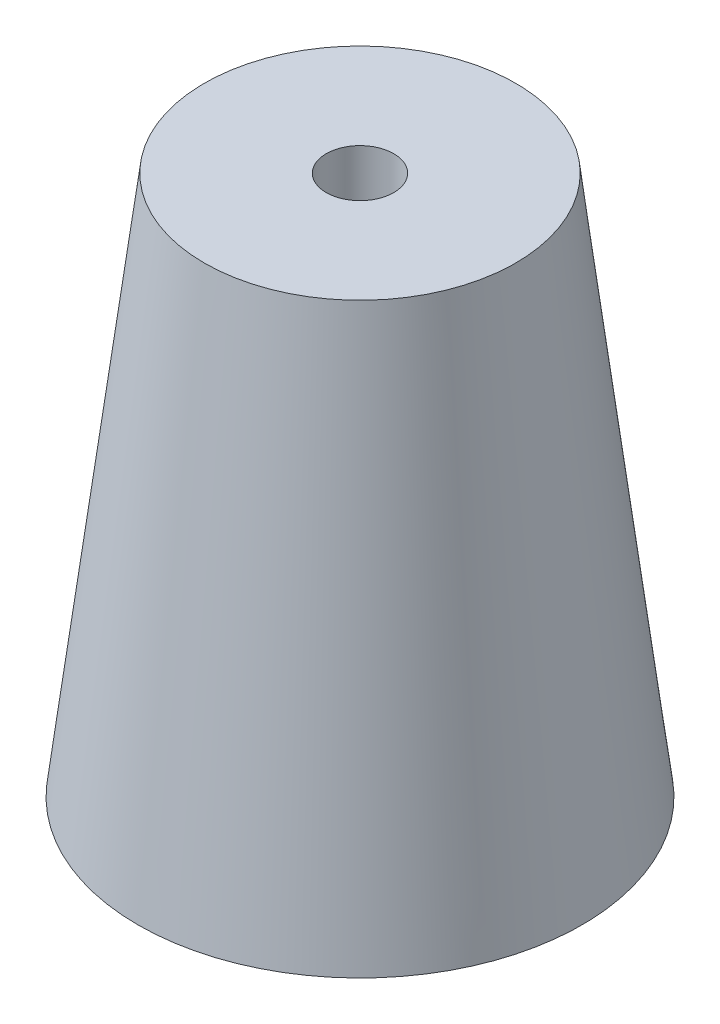
from build123d import *

# Parameters (mm, degrees)
SKETCH1_R               = 23.495
BOSS_EXTRUDE1_DEPTH     = 57.15
BOSS_EXTRUDE1_TAPER     = 7
F_1_4_CLEARANCE_HOLE1_D = 7.14248


with BuildPart() as part:
    # Sketch1 → Boss-Extrude1 (new body)
    with BuildSketch(Plane(origin=(0, 0, 0), x_dir=(1, 0, 0), z_dir=(0, 1, 0))):
        Circle(SKETCH1_R)
    extrude(amount=BOSS_EXTRUDE1_DEPTH, taper=BOSS_EXTRUDE1_TAPER)

    # 1/4 Clearance Hole1 (through all)
    with Locations(Plane(origin=(0, 0, 0), x_dir=(-1, 0, 0), z_dir=(0, -1, 0))):
        with Locations((0, 0)):
            Hole(F_1_4_CLEARANCE_HOLE1_D / 2)


solid = part.part
